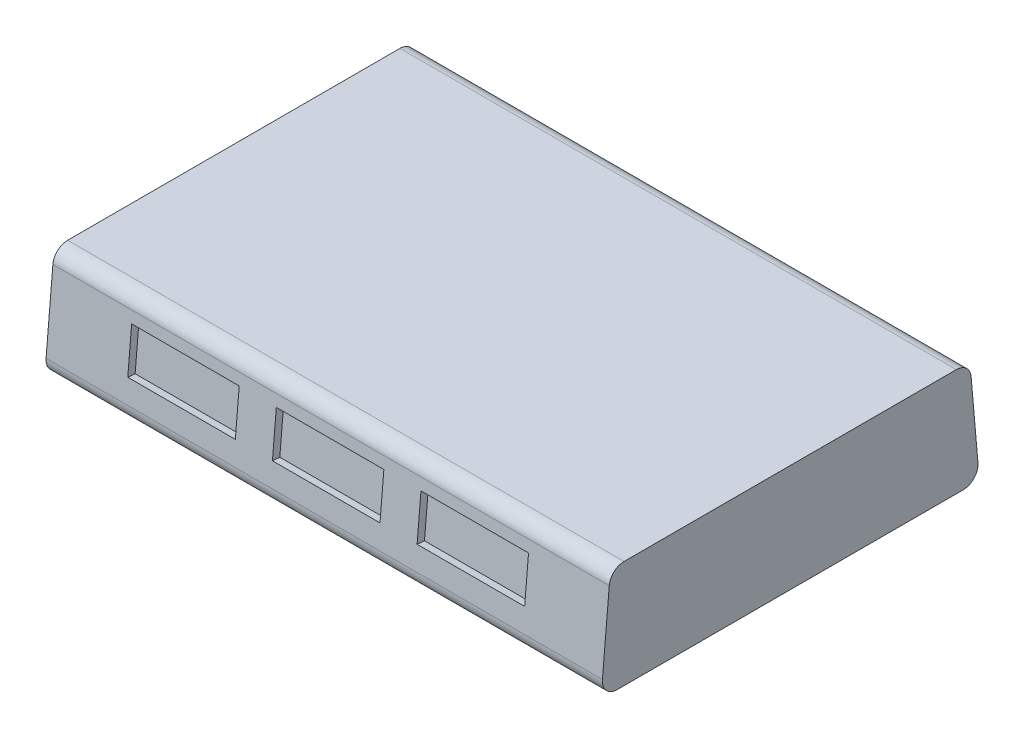
from build123d import *

# Parameters (mm, degrees)
BOSS_EXTRUDE1_DEPTH = 37.5
SKETCH2_W           = 14.5
SKETCH2_H           = 6
CUT_EXTRUDE1_DEPTH  = 1
SKETCH3_W           = 15
SKETCH3_H           = 2
SKETCH3_W_2         = 9
SKETCH3_H_2         = 7
CUT_EXTRUDE2_DEPTH  = 1


with BuildPart() as part:
    # Sketch1 → Boss-Extrude1 (new, symmetric)
    with BuildSketch(Plane(origin=(0, 0, 0), x_dir=(0, 0, -1), z_dir=(1, 0, 0))):
        with BuildLine():
            Line((-24.391141427, 5.424311485), (-25.309772394, -5.075688515))
            ThreePointArc((-25.309772394, -5.075688515), (-24.791937671, -6.601180415), (-23.317382998, -7.25))
            Line((-23.317382998, -7.25), (23.317382998, -7.25))
            ThreePointArc((23.317382998, -7.25), (24.791937671, -6.601180415), (25.309772394, -5.075688515))
            Line((25.309772394, -5.075688515), (24.391141427, 5.424311485))
            ThreePointArc((24.391141427, 5.424311485), (23.749932446, 6.724554674), (22.398752031, 7.25))
            Line((22.398752031, 7.25), (-22.398752031, 7.25))
            ThreePointArc((-22.398752031, 7.25), (-23.749932446, 6.724554674), (-24.391141427, 5.424311485))
        make_face()
    extrude(amount=BOSS_EXTRUDE1_DEPTH, both=True)

    # Sketch2 → Cut-Extrude1 (cut)
    with BuildSketch(Plane(origin=(0, 2.15894237, 24.676824207), x_dir=(1, 0, 0), z_dir=(0, 0.08715574274765166, 0.9961946980917462))):
        with Locations((-19.5, -1.222157705)):
            Rectangle(SKETCH2_W, SKETCH2_H)
        with Locations((0, -1.222157705)):
            Rectangle(SKETCH2_W, SKETCH2_H)
        with Locations((19.5, -1.222157705)):
            Rectangle(SKETCH2_W, SKETCH2_H)
    extrude(amount=-CUT_EXTRUDE1_DEPTH, mode=Mode.SUBTRACT)

    # Sketch3 → Cut-Extrude2 (cut)
    with BuildSketch(Plane(origin=(0, 2.15894237, -24.676824207), x_dir=(-1, 0, 0), z_dir=(0, 0.08715574274765166, -0.9961946980917462))):
        with Locations((19.25, -2.222157705)):
            Rectangle(SKETCH3_W, SKETCH3_H)
        with Locations((-13, -1.992211852)):
            Rectangle(SKETCH3_W_2, SKETCH3_H_2)
    extrude(amount=-CUT_EXTRUDE2_DEPTH, mode=Mode.SUBTRACT)


solid = part.part
